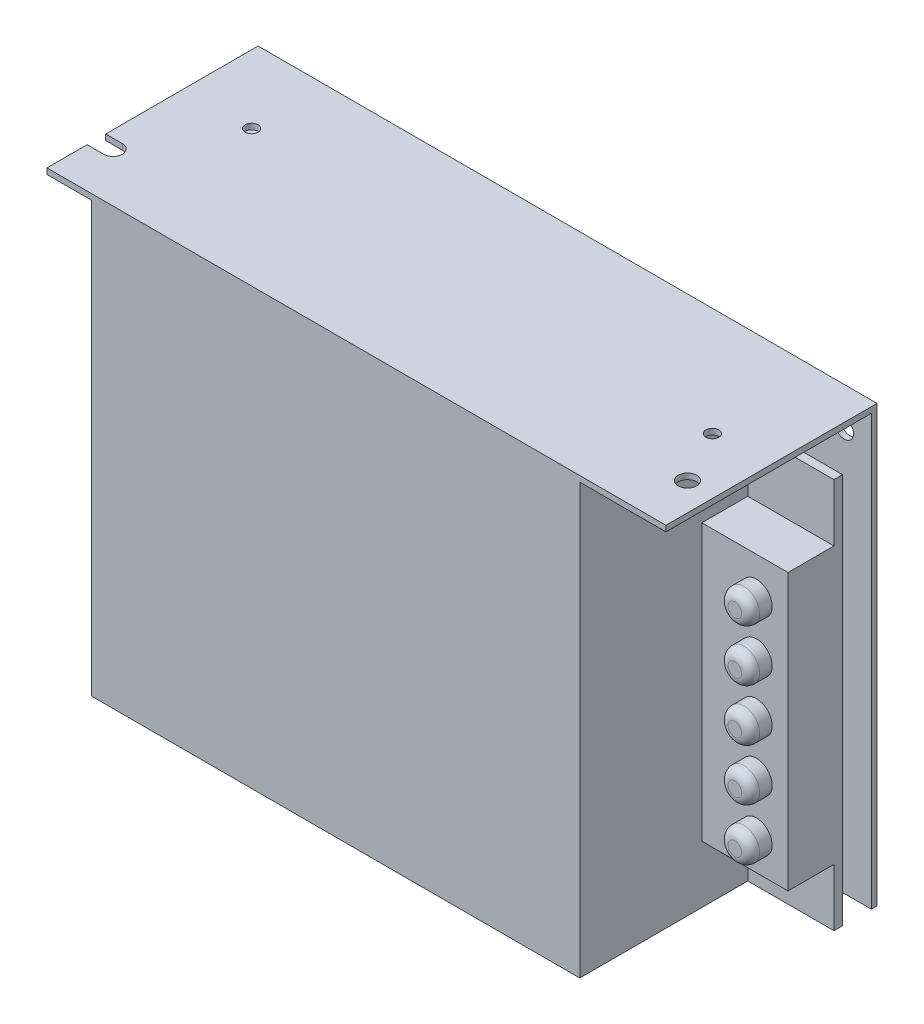
from build123d import *

# Parameters (mm, degrees)
SKETCH1_W              = 109.474
SKETCH1_H              = 76.962
BOSS_EXTRUDE1_DEPTH    = 1.016
SKETCH2_W              = 109.474
SKETCH2_H              = 1.016
BOSS_EXTRUDE2_DEPTH    = 36.322
SKETCH3_R              = 1.6383
CUT_EXTRUDE1_DEPTH     = 139.661435893
SKETCH4_W              = 86.36
SKETCH4_H              = 75.946
BOSS_EXTRUDE3_DEPTH    = 36.322
SKETCH5_R              = 1.6383
SKETCH5_R_2            = 1.143
CUT_EXTRUDE2_DEPTH     = 1.016
SKETCH6_R              = 1.143
CUT_EXTRUDE3_DEPTH     = 6.35
SKETCH7_W              = 1.524
SKETCH7_H              = 75.946
BOSS_EXTRUDE4_DEPTH    = 15.24
CUT_EXTRUDE4_REACH     = 139.08
SKETCH8_W              = 7.62
SKETCH8_H              = 6.858
SKETCH9_W              = 15.24
SKETCH9_H              = 48.768
BOSS_EXTRUDE5_DEPTH    = 8.128
SKETCH10_R             = 2.794
BOSS_EXTRUDE6_DEPTH    = 3.81
FILLET1_R              = 1.5875
LPATTERN2_COUNT        = 5
LPATTERN2_PITCH        = 9.144
FILLET1_OF_LPATTERN2_R = 1.5875
BOSS_EXTRUDE7_DEPTH    = 65.786


with BuildPart() as part:
    # Sketch1 → Boss-Extrude1 (new body)
    with BuildSketch(Plane.XY):
        with Locations((54.737, 38.481)):
            Rectangle(SKETCH1_W, SKETCH1_H)
    extrude(amount=BOSS_EXTRUDE1_DEPTH)

    # Sketch2 → Boss-Extrude2 (add)
    with BuildSketch(Plane.XY.offset(1.016)):
        with Locations((54.737, 76.454)):
            Rectangle(SKETCH2_W, SKETCH2_H)
    extrude(amount=BOSS_EXTRUDE2_DEPTH)

    # Sketch3 → Cut-Extrude1 (cut, through all)
    with BuildSketch(Plane.XY.offset(1.016)):
        with Locations((104.6861, 71.2343)):
            Circle(SKETCH3_R)
        with BuildLine():
            Line((2.2225, 2.286), (0, 2.286))
            Line((0, 2.286), (0, 5.969))
            Line((0, 5.969), (2.2225, 5.969))
            ThreePointArc((2.2225, 5.969), (4.064, 4.1275), (2.2225, 2.286))
        make_face()
    extrude(amount=-CUT_EXTRUDE1_DEPTH, mode=Mode.SUBTRACT)

    # Sketch4 → Boss-Extrude3 (add)
    with BuildSketch(Plane.XY.offset(1.016)):
        with Locations((51.054, 37.973)):
            Rectangle(SKETCH4_W, SKETCH4_H)
    extrude(amount=BOSS_EXTRUDE3_DEPTH)

    # Sketch5 → Cut-Extrude2 (cut)
    with BuildSketch(Plane(origin=(0, 76.962, 0), x_dir=(1, 0, 0), z_dir=(0, 1, 0))):
        with Locations(Location((104.5337, -28.5877, 0), (0, 0, 270))):
            Circle(SKETCH5_R)
        with Locations(Location((99.5426, -19.177, 0), (0, 0, 270))):
            Circle(SKETCH5_R_2)
        with Locations(Location((12.065, -13.208, 0), (0, 0, 270))):
            Circle(SKETCH5_R_2)
        with BuildLine():
            Line((2.9337, -26.9494), (0, -26.9494))
            Line((0, -26.9494), (0, -30.226))
            Line((0, -30.226), (2.9337, -30.226))
            ThreePointArc((2.9337, -30.226), (4.572, -28.5877), (2.9337, -26.9494))
        make_face()
    extrude(amount=-CUT_EXTRUDE2_DEPTH, mode=Mode.SUBTRACT)

    # Sketch6 → Cut-Extrude3 (cut)
    with BuildSketch(Plane(origin=(0, 0, 0), x_dir=(-1, 0, 0), z_dir=(0, 0, -1))):
        with Locations((-78.1304, 24.8412)):
            Circle(SKETCH6_R)
        with Locations((-42.3164, 24.8412)):
            Circle(SKETCH6_R)
        with Locations((-42.3164, 52.5272)):
            Circle(SKETCH6_R)
    extrude(amount=-CUT_EXTRUDE3_DEPTH, mode=Mode.SUBTRACT)

    # Sketch7 → Boss-Extrude4 (add)
    with BuildSketch(Plane(origin=(94.234, 0, 0), x_dir=(0, 0, -1), z_dir=(1, 0, 0))):
        with Locations((-6.858, 37.973)):
            Rectangle(SKETCH7_W, SKETCH7_H)
    extrude(amount=BOSS_EXTRUDE4_DEPTH)

    # Sketch8 → Cut-Extrude4 (cut, up to next)
    with BuildSketch(Plane.XY.offset(7.62), mode=Mode.PRIVATE) as cut_extrude4_sk1:
        with Locations((105.664, 72.517)):
            Rectangle(SKETCH8_W, SKETCH8_H)
    cut_extrude4_tool1 = extrude(cut_extrude4_sk1.sketch, amount=-CUT_EXTRUDE4_REACH, mode=Mode.PRIVATE) & part.part
    add(cut_extrude4_tool1.solids().sort_by_distance((105.664, 72.517, 7.62))[0], mode=Mode.SUBTRACT)

    # Sketch9 → Boss-Extrude5 (add)
    with BuildSketch(Plane.XY.offset(7.62)):
        with Locations((101.854, 34.544)):
            Rectangle(SKETCH9_W, SKETCH9_H)
    extrude(amount=BOSS_EXTRUDE5_DEPTH)

    # Sketch10 → Boss-Extrude6 (add)
    with BuildSketch(Plane.XY.offset(15.748)):
        with Locations(Location((103.886, 15.748, 0), (0, 0, 180))):
            Circle(SKETCH10_R)
    boss_extrude6 = extrude(amount=BOSS_EXTRUDE6_DEPTH)

    # Fillet1
    fillet1_edges = [part.edges().sort_by_distance(p)[0] for p in [
        (106.68, 15.748, 19.558),
    ]]
    fillet(fillet1_edges, radius=FILLET1_R)

    # LPattern2: Boss-Extrude6 ×5
    with Locations(*[(0, i * LPATTERN2_PITCH, 0) for i in range(1, LPATTERN2_COUNT)]):
        add(boss_extrude6)

    # Fillet1 of LPattern2
    fillet1_of_lpattern2_edges = [part.edges().sort_by_distance(p)[0] for p in [
        (106.68, 24.892, 19.558),
        (106.68, 34.036, 19.558),
        (106.68, 43.18, 19.558),
        (106.68, 52.324, 19.558),
    ]]
    fillet(fillet1_of_lpattern2_edges, radius=FILLET1_OF_LPATTERN2_R)

    # Sketch11 → Boss-Extrude7 (add)
    with BuildSketch(Plane.XZ.offset(-75.946)):
        Polygon((7.874, 1.016), (0, 1.016), (0, 6.096), (7.874, 11.176), align=None)
    extrude(amount=BOSS_EXTRUDE7_DEPTH)


solid = part.part
